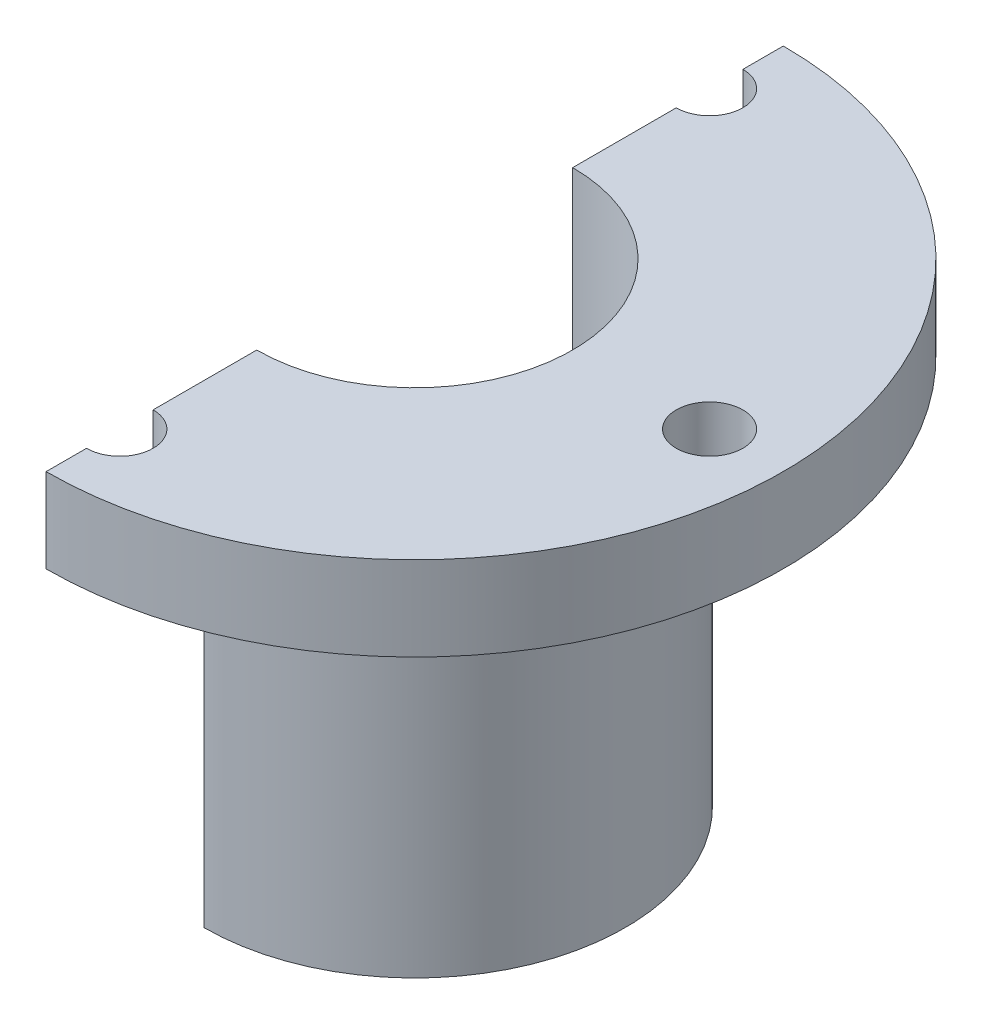
from build123d import *

# Parameters (mm, degrees)
BASE_R_VOLUTION_ANGLE   = 180
ESQUISSE2_R             = 3.16227766
ENL_V_MAT_EXTRU_1_DEPTH = 67.895440801


with BuildPart() as part:
    # Esquisse1 → Base-Révolution (revolve)
    with BuildSketch(Plane(origin=(0, 0, 0), x_dir=(0, 0, -1), z_dir=(1, 0, 0))):
        Polygon((-7, 0), (-7, 6), (-15, 6), (-15, 25), (-35, 25), (-35, 17), (-20, 17), (-20, -20), (-17.5, -20), (-17.5, 0), align=None)
    revolve(axis=Axis((0, 0, 0), (0, 1, 0)), revolution_arc=BASE_R_VOLUTION_ANGLE)

    # Esquisse2 → Enlèv. mat.-Extru.1 (cut, through all)
    with BuildSketch(Plane(origin=(0, 25, 0), x_dir=(-1, 0, 0), z_dir=(0, 1, 0))):
        with Locations((0, -28)):
            Circle(ESQUISSE2_R)
        with Locations((0, 28)):
            Circle(ESQUISSE2_R)
        with Locations(Location((-28, 0, 0), (0, 0, 90))):
            Circle(ESQUISSE2_R)
    extrude(amount=-ENL_V_MAT_EXTRU_1_DEPTH, mode=Mode.SUBTRACT)


solid = part.part
